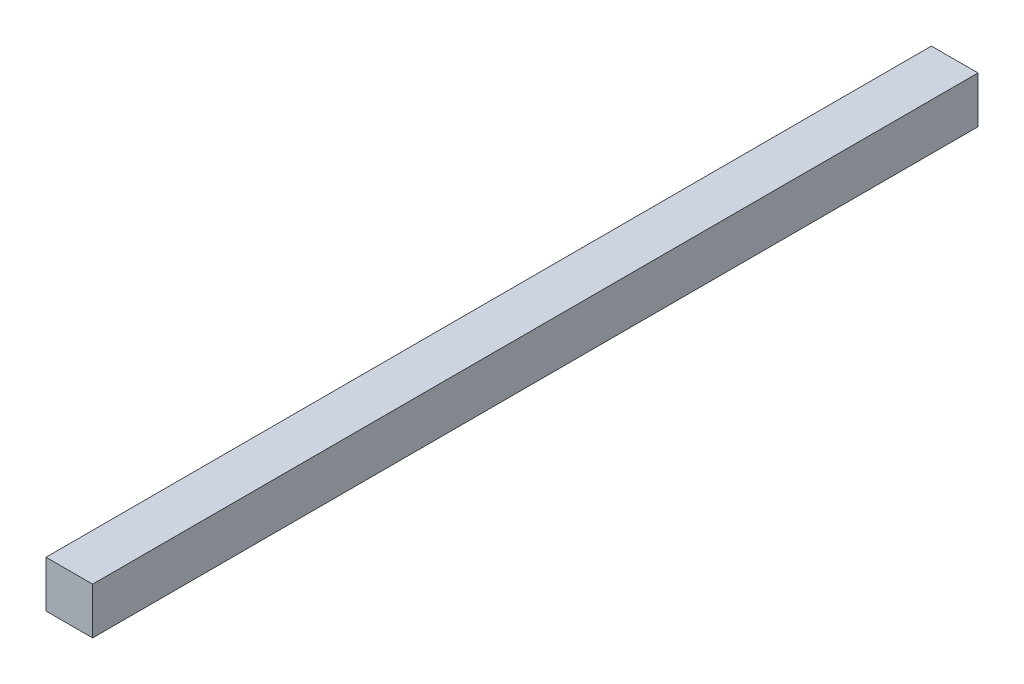
from build123d import *

# Parameters (mm, degrees)
SKETCH1_W           = 25.4
SKETCH1_H           = 482.6
BOSS_EXTRUDE1_DEPTH = 25.4


with BuildPart() as part:
    # Sketch1 → Boss-Extrude1 (new body)
    with BuildSketch(Plane(origin=(0, 0, 0), x_dir=(1, 0, 0), z_dir=(0, 1, 0))):
        Rectangle(SKETCH1_W, SKETCH1_H)
    extrude(amount=BOSS_EXTRUDE1_DEPTH)


solid = part.part
